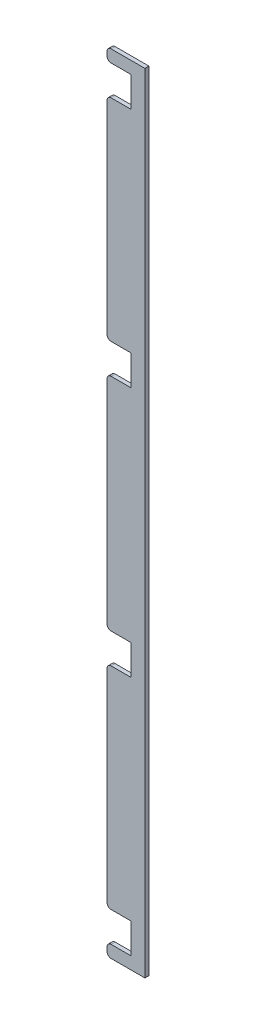
from build123d import *

# Parameters (mm, degrees)
BOSS_EXTRUDE1_DEPTH = 1


with BuildPart() as part:
    # Sketch1 → Boss-Extrude1 (new body)
    with BuildSketch(Plane.XY):
        with BuildLine():
            Line((-4.5, -182.595238095), (0, -182.595238095))
            Line((0, -182.595238095), (0, 13.404761905))
            Line((0, 13.404761905), (-4.5, 13.404761905))
            Line((-4.5, 13.404761905), (-8.4, 13.404761905))
            ThreePointArc((-8.4, 13.404761905), (-9.107106781, 13.111868686), (-9.4, 12.404761905))
            Line((-9.4, 12.404761905), (-9.4, 11.354761905))
            ThreePointArc((-9.4, 11.354761905), (-9.107106781, 10.647655124), (-8.4, 10.354761905))
            Line((-8.4, 10.354761905), (-4.5, 10.354761905))
            Line((-4.5, 10.354761905), (-3.5, 10.354761905))
            Line((-3.5, 10.354761905), (-3.5, 2.854761905))
            Line((-3.5, 2.854761905), (-4.5, 2.854761905))
            Line((-4.5, 2.854761905), (-8.4, 2.854761905))
            ThreePointArc((-8.4, 2.854761905), (-9.107106781, 2.561868686), (-9.4, 1.854761905))
            Line((-9.4, 1.854761905), (-9.4, -48.645238095))
            ThreePointArc((-9.4, -48.645238095), (-9.107106781, -49.352344876), (-8.4, -49.645238095))
            Line((-8.4, -49.645238095), (-4.5, -49.645238095))
            Line((-4.5, -49.645238095), (-3.5, -49.645238095))
            Line((-3.5, -49.645238095), (-3.5, -57.145238095))
            Line((-3.5, -57.145238095), (-4.5, -57.145238095))
            Line((-4.5, -57.145238095), (-8.4, -57.145238095))
            ThreePointArc((-8.4, -57.145238095), (-9.107106781, -57.438131314), (-9.4, -58.145238095))
            Line((-9.4, -58.145238095), (-9.4, -111.045238095))
            ThreePointArc((-9.4, -111.045238095), (-9.107106781, -111.752344876), (-8.4, -112.045238095))
            Line((-8.4, -112.045238095), (-4.5, -112.045238095))
            Line((-4.5, -112.045238095), (-3.5, -112.045238095))
            Line((-3.5, -112.045238095), (-3.5, -119.545238095))
            Line((-3.5, -119.545238095), (-4.5, -119.545238095))
            Line((-4.5, -119.545238095), (-8.4, -119.545238095))
            ThreePointArc((-8.4, -119.545238095), (-9.107106781, -119.838131314), (-9.4, -120.545238095))
            Line((-9.4, -120.545238095), (-9.4, -171.045238095))
            ThreePointArc((-9.4, -171.045238095), (-9.107106781, -171.752344876), (-8.4, -172.045238095))
            Line((-8.4, -172.045238095), (-4.5, -172.045238095))
            Line((-4.5, -172.045238095), (-3.5, -172.045238095))
            Line((-3.5, -172.045238095), (-3.5, -179.545238095))
            Line((-3.5, -179.545238095), (-4.5, -179.545238095))
            Line((-4.5, -179.545238095), (-8.4, -179.545238095))
            ThreePointArc((-8.4, -179.545238095), (-9.107106781, -179.838131314), (-9.4, -180.545238095))
            Line((-9.4, -180.545238095), (-9.4, -181.595238095))
            ThreePointArc((-9.4, -181.595238095), (-9.107106781, -182.302344876), (-8.4, -182.595238095))
            Line((-8.4, -182.595238095), (-4.5, -182.595238095))
        make_face()
    extrude(amount=BOSS_EXTRUDE1_DEPTH)


solid = part.part
